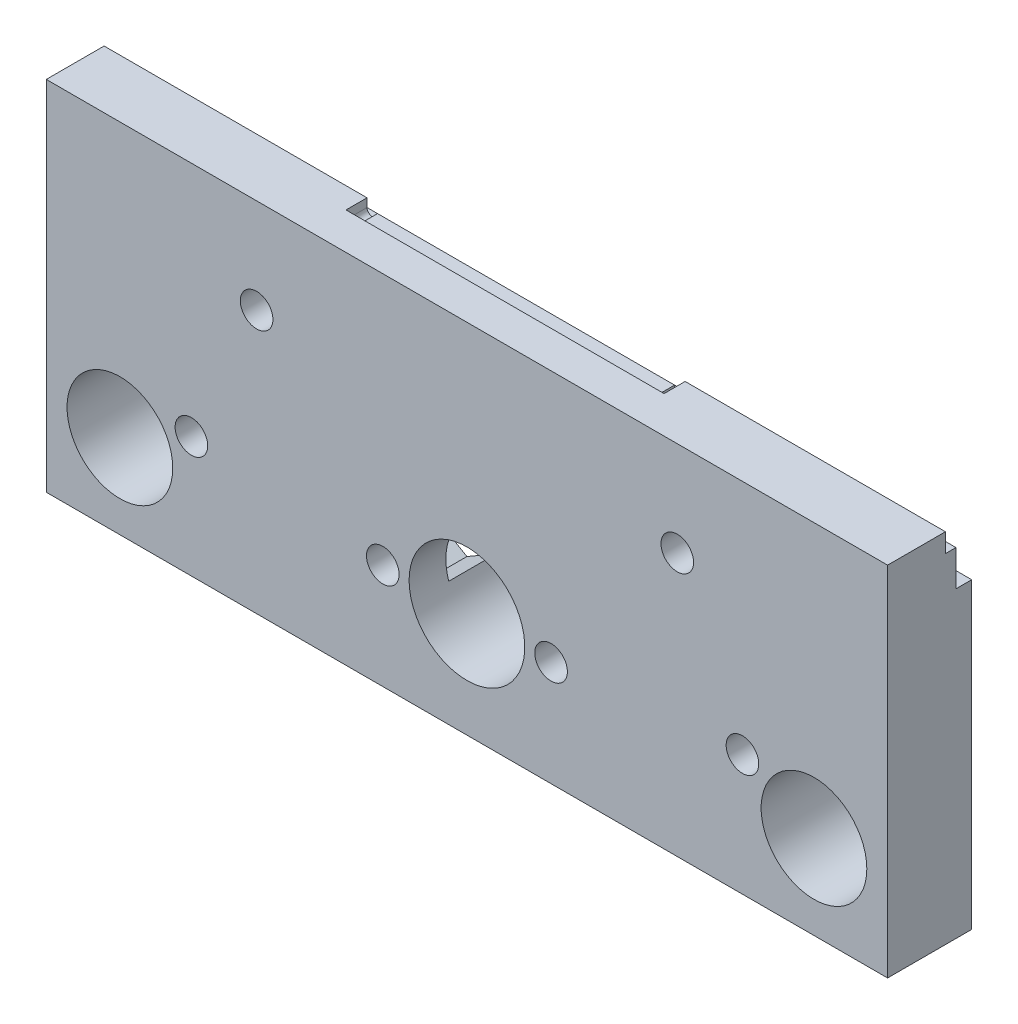
from build123d import *

# Parameters (mm, degrees)
SKETCH_2_W           = 80
SKETCH_2_H           = 34
SKETCH_2_R           = 5.025
SKETCH_2_R_2         = 4.05
EXTRUDE_1_DEPTH      = 8
CUT_EXTRUDE_2_DEPTH  = 88.292611371
SKETCH_5_R           = 1.55
CUT_EXTRUDE_3_DEPTH  = 88.292611371
CUT_EXTRUDE_5_DEPTH  = 4.5
SKETCH_11_R          = 1.55
CUT_EXTRUDE_7_DEPTH  = 88.292611371
CUT_EXTRUDE_11_DEPTH = 2
SKETCH_22_R          = 1.55
CUT_EXTRUDE_13_DEPTH = 88.292611371
SKETCH_20_R          = 5.5
CUT_EXTRUDE_14_DEPTH = 88.292611371


with BuildPart() as part:
    # 草图2 → 凸台-拉伸1 (new body)
    with BuildSketch(Plane.XY):
        with Locations((40, 17)):
            Rectangle(SKETCH_2_W, SKETCH_2_H)
        with Locations((7, 8)):
            Circle(SKETCH_2_R, mode=Mode.SUBTRACT)
        with Locations((40, 10)):
            Circle(SKETCH_2_R_2, mode=Mode.SUBTRACT)
        with Locations((73, 8)):
            Circle(SKETCH_2_R, mode=Mode.SUBTRACT)
    extrude(amount=EXTRUDE_1_DEPTH)

    # 草图4 → 切除-拉伸2 (cut, through all)
    with BuildSketch(Plane(origin=(80, 0, 0), x_dir=(0, 0, -1), z_dir=(1, 0, 0))):
        Polygon((-1.5, 32.2), (-2.5, 32.2), (-2.5, 34), (0, 34), (0, 28.8), (-1.5, 28.8), align=None)
    extrude(amount=-CUT_EXTRUDE_2_DEPTH, mode=Mode.SUBTRACT)

    # 草图5 → 切除-拉伸3 (cut, through all)
    with BuildSketch(Plane.XY.offset(8)):
        with Locations((48, 10)):
            Circle(SKETCH_5_R)
        with Locations((32, 10)):
            Circle(SKETCH_5_R)
    extrude(amount=-CUT_EXTRUDE_3_DEPTH, mode=Mode.SUBTRACT)

    # 草图8 → 切除-拉伸5 (cut)
    with BuildSketch(Plane(origin=(0, 0, 0), x_dir=(-1, 0, 0), z_dir=(0, 0, -1))):
        Polygon((-45.15, 8.354551733), (-45.15, 11.645448267), (-48, 13.290896534), (-50.85, 11.645448267), (-50.85, 8.354551733), (-48, 6.709103466), align=None)
        Polygon((-34.85, 8.354551733), (-32, 6.709103466), (-29.15, 8.354551733), (-29.15, 11.645448267), (-32, 13.290896534), (-34.85, 11.645448267), align=None)
    extrude(amount=-CUT_EXTRUDE_5_DEPTH, mode=Mode.SUBTRACT)

    # 草图11 → 切除-拉伸7 (cut, through all)
    with BuildSketch(Plane(origin=(0, 0, 0), x_dir=(-1, 0, 0), z_dir=(0, 0, -1))):
        with Locations((-60, 25)):
            Circle(SKETCH_11_R)
        with Locations((-20, 25)):
            Circle(SKETCH_11_R)
    extrude(amount=-CUT_EXTRUDE_7_DEPTH, mode=Mode.SUBTRACT)

    # 草图19 → 切除-拉伸11 (cut)
    with BuildSketch(Plane(origin=(0, 0, 2.5), x_dir=(-1, 0, 0), z_dir=(0, 0, -1))):
        with BuildLine():
            Line((-25, 34), (-55.247938178, 34))
            Line((-55.247938178, 34), (-55.247938178, 33.2))
            ThreePointArc((-55.247938178, 33.2), (-54.747938178, 32.7), (-54.247938178, 33.2))
            Line((-54.247938178, 33.2), (-26, 33.2))
            ThreePointArc((-26, 33.2), (-25.5, 32.7), (-25, 33.2))
            Line((-25, 33.2), (-25, 34))
        make_face()
    extrude(amount=-CUT_EXTRUDE_11_DEPTH, mode=Mode.SUBTRACT)

    # 草图22 → 切除-拉伸13 (cut, through all)
    with BuildSketch(Plane(origin=(0, 0, 0), x_dir=(-1, 0, 0), z_dir=(0, 0, -1))):
        with Locations((-66.2, 11.5)):
            Circle(SKETCH_22_R)
        with Locations(Location((-13.8, 11.5, 0), (0, 0, 180))):
            Circle(SKETCH_22_R)
    extrude(amount=-CUT_EXTRUDE_13_DEPTH, mode=Mode.SUBTRACT)

    # 草图20 → 切除-拉伸14 (cut, through all)
    with BuildSketch(Plane(origin=(0, 0, 0), x_dir=(-1, 0, 0), z_dir=(0, 0, -1))):
        with Locations((-40, 10)):
            Circle(SKETCH_20_R)
    extrude(amount=-CUT_EXTRUDE_14_DEPTH, mode=Mode.SUBTRACT)


solid = part.part
